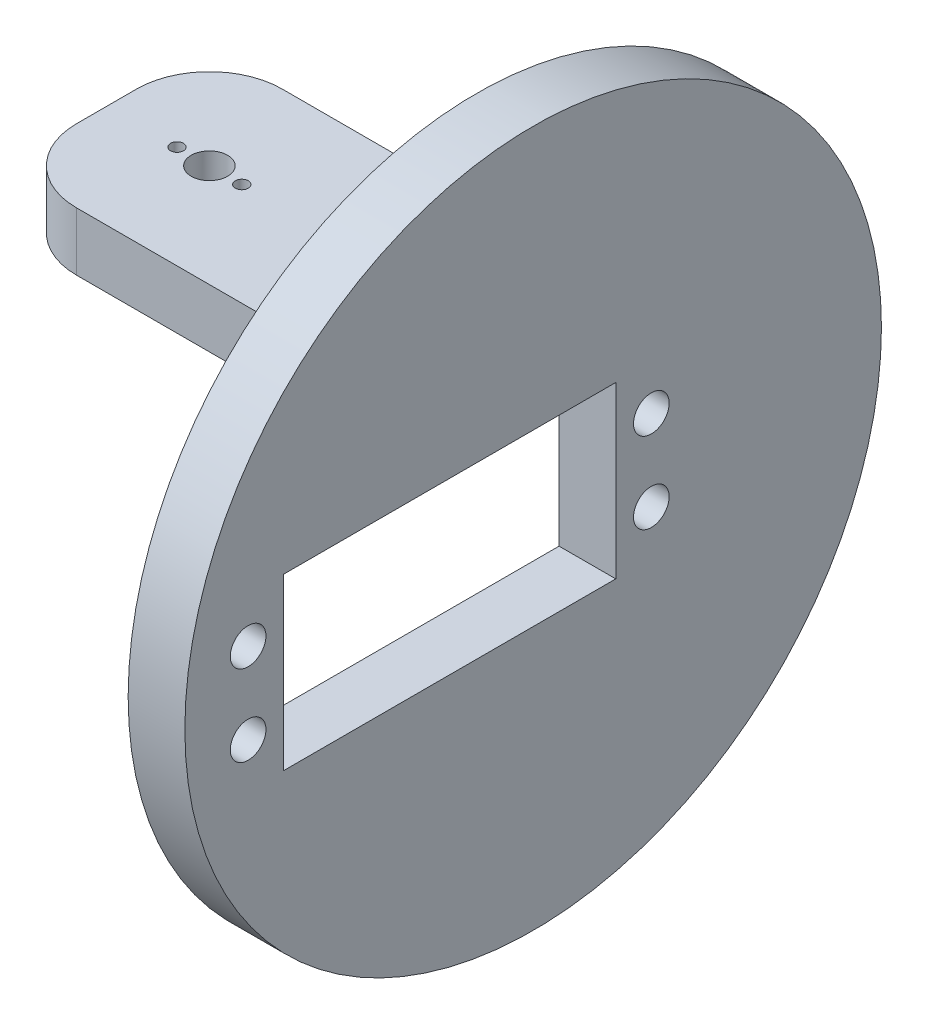
from build123d import *

# Parameters (mm, degrees)
SKETCH1_W           = 45
SKETCH1_H           = 25.4
BOSS_EXTRUDE1_DEPTH = 7.2
FILLET1_R           = 9
SKETCH5_R           = 2.25
SKETCH5_R_2         = 0.8
CUT_EXTRUDE1_DEPTH  = 32.680717235
CUT_EXTRUDE2_DEPTH  = 4
SKETCH7_R           = 43
BOSS_EXTRUDE2_DEPTH = 7
CUT_EXTRUDE5_REACH  = 89.211
SKETCH10_R          = 4.070055362
CUT_EXTRUDE6_REACH  = 85.227
SKETCH11_R          = 2.2
SKETCH11_W          = 41
SKETCH11_H          = 21


with BuildPart() as part:
    # Sketch1 → Boss-Extrude1 (new body)
    with BuildSketch(Plane(origin=(0, 0, 0), x_dir=(1, 0, 0), z_dir=(0, 1, 0))):
        with Locations((-5.305107108, -0.668016429)):
            Rectangle(SKETCH1_W, SKETCH1_H)
    extrude(amount=BOSS_EXTRUDE1_DEPTH)

    # Fillet1
    fillet1_edges = [part.edges().sort_by_distance(p)[0] for p in [
        (-27.805107108, 3.6, -12.031983571),
        (-27.805107108, 3.6, 13.368016429),
    ]]
    fillet(fillet1_edges, radius=FILLET1_R)

    # Sketch5 → Cut-Extrude1 (cut, through all)
    with BuildSketch(Plane(origin=(0, 7.2, 0), x_dir=(1, 0, 0), z_dir=(0, 1, 0))):
        with Locations(Location((-15.105107108, -0.668016429, 0), (0, 0, 270))):
            Circle(SKETCH5_R)
        with Locations(Location((-19.105107108, -0.668016429, 0), (0, 0, 270))):
            Circle(SKETCH5_R_2)
        with Locations(Location((-11.105107108, -0.668016429, 0), (0, 0, 270))):
            Circle(SKETCH5_R_2)
    extrude(amount=-CUT_EXTRUDE1_DEPTH, mode=Mode.SUBTRACT)

    # Sketch6 → Cut-Extrude2 (cut)
    with BuildSketch(Plane.XZ):
        with BuildLine():
            Line((-19.105107108, 3.818299004), (-11.105107108, 3.818299004))
            ThreePointArc((-11.105107108, 3.818299004), (-7.954824533, 0.668016429), (-11.105107108, -2.482266146))
            Line((-11.105107108, -2.482266146), (-19.105107108, -2.482266146))
            ThreePointArc((-19.105107108, -2.482266146), (-22.255389683, 0.668016429), (-19.105107108, 3.818299004))
        make_face()
    extrude(amount=-CUT_EXTRUDE2_DEPTH, mode=Mode.SUBTRACT)

    # Sketch7 → Boss-Extrude2 (add)
    with BuildSketch(Plane(origin=(17.194892892, 0, 0), x_dir=(0, 0, -1), z_dir=(1, 0, 0))):
        with Locations((0, -12.251447975)):
            Circle(SKETCH7_R)
    extrude(amount=BOSS_EXTRUDE2_DEPTH)

    # Sketch10 → Cut-Extrude5 (cut, up to next)
    with BuildSketch(Plane(origin=(24.194892892, 0, 0), x_dir=(0, 0, -1), z_dir=(1, 0, 0)), mode=Mode.PRIVATE) as cut_extrude5_sk1:
        with Locations((0, -12.251447975)):
            Circle(SKETCH10_R)
    cut_extrude5_tool1 = extrude(cut_extrude5_sk1.sketch, amount=-CUT_EXTRUDE5_REACH, mode=Mode.PRIVATE) & part.part
    add(cut_extrude5_tool1.solids().sort_by_distance((24.194893, -12.251448, 0))[0], mode=Mode.SUBTRACT)

    # Sketch11 → Cut-Extrude6 (cut, up to next)
    with BuildSketch(Plane.ZY.offset(-17.194892892), mode=Mode.PRIVATE) as cut_extrude6_sk1:
        with Locations((35.189613301, -7.251447975)):
            Circle(SKETCH11_R)
    cut_extrude6_tool1 = extrude(cut_extrude6_sk1.sketch, amount=-CUT_EXTRUDE6_REACH, mode=Mode.PRIVATE) & part.part
    # Sketch11 → Cut-Extrude6 (cut, up to next)
    with BuildSketch(Plane.ZY.offset(-17.194892892), mode=Mode.PRIVATE) as cut_extrude6_sk2:
        with Locations((35.189613301, -17.251447975)):
            Circle(SKETCH11_R)
    cut_extrude6_tool2 = extrude(cut_extrude6_sk2.sketch, amount=-CUT_EXTRUDE6_REACH, mode=Mode.PRIVATE) & part.part
    # Sketch11 → Cut-Extrude6 (cut, up to next)
    with BuildSketch(Plane.ZY.offset(-17.194892892), mode=Mode.PRIVATE) as cut_extrude6_sk3:
        with Locations((-14.589613301, -7.251447975)):
            Circle(SKETCH11_R)
    cut_extrude6_tool3 = extrude(cut_extrude6_sk3.sketch, amount=-CUT_EXTRUDE6_REACH, mode=Mode.PRIVATE) & part.part
    # Sketch11 → Cut-Extrude6 (cut, up to next)
    with BuildSketch(Plane.ZY.offset(-17.194892892), mode=Mode.PRIVATE) as cut_extrude6_sk4:
        with Locations((-14.589613301, -17.251447975)):
            Circle(SKETCH11_R)
    cut_extrude6_tool4 = extrude(cut_extrude6_sk4.sketch, amount=-CUT_EXTRUDE6_REACH, mode=Mode.PRIVATE) & part.part
    # Sketch11 → Cut-Extrude6 (cut, up to next)
    with BuildSketch(Plane.ZY.offset(-17.194892892), mode=Mode.PRIVATE) as cut_extrude6_sk5:
        with Locations((10.3, -12.251447975)):
            Rectangle(SKETCH11_W, SKETCH11_H)
    cut_extrude6_tool5 = extrude(cut_extrude6_sk5.sketch, amount=-CUT_EXTRUDE6_REACH, mode=Mode.PRIVATE) & part.part
    add(cut_extrude6_tool1.solids().sort_by_distance((17.194893, -7.251448, 35.189613))[0], mode=Mode.SUBTRACT)
    add(cut_extrude6_tool2.solids().sort_by_distance((17.194893, -17.251448, 35.189613))[0], mode=Mode.SUBTRACT)
    add(cut_extrude6_tool3.solids().sort_by_distance((17.194893, -7.251448, -14.589613))[0], mode=Mode.SUBTRACT)
    add(cut_extrude6_tool4.solids().sort_by_distance((17.194893, -17.251448, -14.589613))[0], mode=Mode.SUBTRACT)
    add(cut_extrude6_tool5.solids().sort_by_distance((17.194893, -12.251448, 10.3))[0], mode=Mode.SUBTRACT)


solid = part.part
